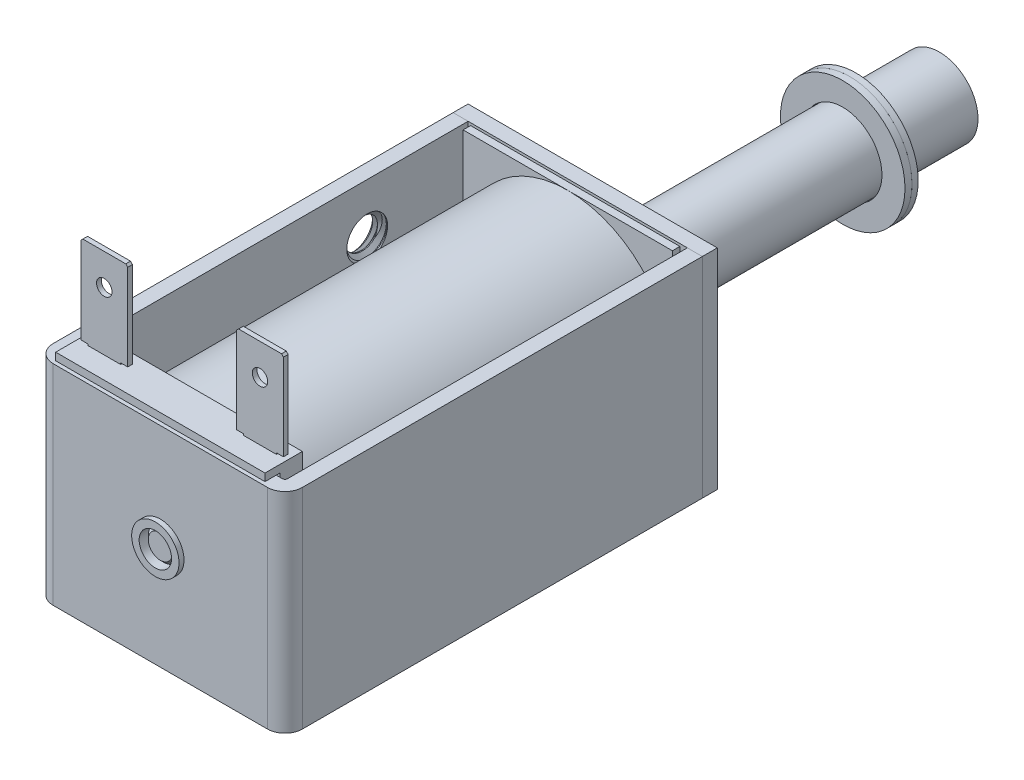
from build123d import *

# Parameters (mm, degrees)
BOSS_EXTRUDE1_DEPTH      = 10.668
BOSS_EXTRUDE1_DEPTH_BACK = 10.668
SKETCH3_W                = 25.4
SKETCH3_H                = 1.524
SKETCH4_R                = 4.34848
CUT_EXTRUDE1_DEPTH       = 1.524
SKETCH5_R                = 4.318
SKETCH5_R_2              = 4.064
BOSS_EXTRUDE2_DEPTH      = 41.656
BOSS_EXTRUDE3_DEPTH      = 10.668
BOSS_EXTRUDE3_DEPTH_BACK = 10.668
SKETCH7_R                = 2.3622
CUT_EXTRUDE2_DEPTH       = 1.524
BOSS_EXTRUDE4_START      = 0.254
SKETCH8_W                = 21.336
SKETCH8_H                = 21.336
SKETCH8_R                = 4.44627
BOSS_EXTRUDE4_DEPTH      = 0.762
SKETCH9_W                = 21.336
SKETCH9_H                = 22.479
SKETCH9_R                = 4.44627
BOSS_EXTRUDE5_DEPTH      = 2.286
SKETCH10_R               = 10.668
SKETCH10_R_2             = 4.44627
BOSS_EXTRUDE6_DEPTH      = 37.719
SKETCH11_W               = 21.336
SKETCH11_H               = 3.81
BOSS_EXTRUDE7_DEPTH      = 0.762
BOSS_EXTRUDE8_START      = -1.10236
SKETCH12_R               = 0.7874
BOSS_EXTRUDE8_DEPTH      = 0.4826
SKETCH15_W               = 0.7112
SKETCH15_H               = 2.3495
BOSS_EXTRUDE9_DEPTH      = 0.635
SKETCH17_R               = 2.0828
BOSS_EXTRUDE10_DEPTH     = 1.524
CUT_SWEEP1_PITCH         = 0.79375
CUT_SWEEP1_HEIGHT        = 2.31775
CUT_SWEEP1_RADIUS        = 2.0828
CUT_SWEEP1_START_ANGLE   = -90
SKETCH20_R               = 2.0828
BOSS_EXTRUDE11_DEPTH     = 0.79375
BOSS_EXTRUDE11_DRAFT     = -45
SKETCH21_R               = 2.0828
BOSS_EXTRUDE12_DEPTH     = 0.79375
BOSS_EXTRUDE12_DRAFT     = -45


with BuildPart() as part:
    # Sketch3 → Boss-Extrude1 (new, two sides: drawn at the far end of the back side and taken through both)
    with BuildSketch(Plane(origin=(0, 0, 0), x_dir=(1, 0, 0), z_dir=(0, 1, 0)).offset(-BOSS_EXTRUDE1_DEPTH_BACK)):
        with Locations((0, 43.307)):
            Rectangle(SKETCH3_W, SKETCH3_H)
    extrude(amount=BOSS_EXTRUDE1_DEPTH + BOSS_EXTRUDE1_DEPTH_BACK)

    # Sketch4 → Cut-Extrude1 (cut)
    with BuildSketch(Plane(origin=(0, 0, -44.069), x_dir=(-1, 0, 0), z_dir=(0, 0, -1))):
        Circle(SKETCH4_R)
    extrude(amount=-CUT_EXTRUDE1_DEPTH, mode=Mode.SUBTRACT)


with BuildPart() as body_2:
    # Sketch5 → Boss-Extrude2 (new body)
    with BuildSketch(Plane(origin=(0, 0, -44.069), x_dir=(-1, 0, 0), z_dir=(0, 0, -1))):
        Circle(SKETCH5_R)
        Circle(SKETCH5_R_2, mode=Mode.SUBTRACT)
    extrude(amount=-BOSS_EXTRUDE2_DEPTH)


with BuildPart() as body_3:
    # Sketch6 → Boss-Extrude3 (new, two sides: drawn at the far end of the back side and taken through both)
    with BuildSketch(Plane(origin=(0, 0, 0), x_dir=(1, 0, 0), z_dir=(0, 1, 0)).offset(-BOSS_EXTRUDE3_DEPTH_BACK)):
        with BuildLine():
            Line((-12.7, 42.545), (-12.7, 1.778))
            ThreePointArc((-12.7, 1.778), (-12.179235857, 0.520764143), (-10.922, 0))
            Line((-10.922, 0), (10.922, 0))
            ThreePointArc((10.922, 0), (12.179235857, 0.520764143), (12.7, 1.778))
            Line((12.7, 1.778), (12.7, 42.545))
            Line((12.7, 42.545), (11.176, 42.545))
            Line((11.176, 42.545), (11.176, 1.778))
            ThreePointArc((11.176, 1.778), (11.101605122, 1.598394878), (10.922, 1.524))
            Line((10.922, 1.524), (-10.922, 1.524))
            ThreePointArc((-10.922, 1.524), (-11.101605122, 1.598394878), (-11.176, 1.778))
            Line((-11.176, 1.778), (-11.176, 42.545))
            Line((-11.176, 42.545), (-12.7, 42.545))
        make_face()
    extrude(amount=BOSS_EXTRUDE3_DEPTH + BOSS_EXTRUDE3_DEPTH_BACK)

    # Sketch7 → Cut-Extrude2 (cut)
    with BuildSketch(Plane.XY):
        Circle(SKETCH7_R)
    extrude(amount=-CUT_EXTRUDE2_DEPTH, mode=Mode.SUBTRACT)


with BuildPart() as body_4:
    # Sketch8 → Boss-Extrude4 (new body)
    with BuildSketch(Plane.XY.offset(-42.545).offset(BOSS_EXTRUDE4_START)):
        Rectangle(SKETCH8_W, SKETCH8_H)
        with Locations(Location((0, 0, 0), (0, 0, 180))):
            Circle(SKETCH8_R, mode=Mode.SUBTRACT)
    extrude(amount=BOSS_EXTRUDE4_DEPTH)



with BuildPart() as body_5:
    # Sketch9 → Boss-Extrude5 (new body)
    with BuildSketch(Plane(origin=(0, 0, -1.524), x_dir=(-1, 0, 0), z_dir=(0, 0, -1))):
        with Locations((0, 0.5715)):
            Rectangle(SKETCH9_W, SKETCH9_H)
        Circle(SKETCH9_R, mode=Mode.SUBTRACT)
    extrude(amount=BOSS_EXTRUDE5_DEPTH)


with BuildPart() as body_4_1:
    add(body_4.part)

    add(body_5.part)  # Boss-Extrude6 merges body 5
    # Sketch10 → Boss-Extrude6 (add)
    with BuildSketch(Plane(origin=(0, 0, -3.81), x_dir=(-1, 0, 0), z_dir=(0, 0, -1))):
        with Locations(Location((0, 0, 0), (0, 0, 180))):
            Circle(SKETCH10_R)
        with Locations(Location((0, 0, 0), (0, 0, 180))):
            Circle(SKETCH10_R_2, mode=Mode.SUBTRACT)
    extrude(amount=BOSS_EXTRUDE6_DEPTH)

    # Sketch11 → Boss-Extrude7 (add)
    with BuildSketch(Plane(origin=(0, 11.811, 0), x_dir=(1, 0, 0), z_dir=(0, 1, 0))):
        with Locations((0, 1.905)):
            Rectangle(SKETCH11_W, SKETCH11_H)
    extrude(amount=-BOSS_EXTRUDE7_DEPTH)

    # Sketch12 → Boss-Extrude8 (add)
    # profile 1 of 2: a face of its own
    with BuildSketch(Plane(origin=(0, 0, -3.81), x_dir=(-1, 0, 0), z_dir=(0, 0, -1)).offset(BOSS_EXTRUDE8_START)):
        Polygon((10.32764, 11.95578), (9.6012, 11.95578), (9.6012, 11.811), (6.2738, 11.811), (6.2738, 11.95578), (5.54736, 11.95578), (5.54736, 20.75434), (5.74802, 20.955), (10.12698, 20.955), (10.32764, 20.75434), align=None)
        with Locations((7.9375, 17.78)):
            Circle(SKETCH12_R, mode=Mode.SUBTRACT)
    # profile 2 of 2: a face of its own
    with BuildSketch(Plane(origin=(0, 0, -3.81), x_dir=(-1, 0, 0), z_dir=(0, 0, -1)).offset(BOSS_EXTRUDE8_START)):
        Polygon((-10.32764, 20.75434), (-10.12698, 20.955), (-5.74802, 20.955), (-5.54736, 20.75434), (-5.54736, 11.95578), (-6.2738, 11.95578), (-6.2738, 11.811), (-9.6012, 11.811), (-9.6012, 11.95578), (-10.32764, 11.95578), align=None)
        with Locations((-7.9375, 17.78)):
            Circle(SKETCH12_R, mode=Mode.SUBTRACT)
    extrude(amount=-BOSS_EXTRUDE8_DEPTH)


with BuildPart() as body_5_2:
    # Sketch13 → Revolve1 (revolve)
    with BuildSketch(Plane(origin=(0, 0, 0), x_dir=(0, 0, -1), z_dir=(1, 0, 0)), mode=Mode.PRIVATE) as revolve1_sk:
        Polygon((-0.508, 2.413), (-0.508, 1.651), (7.9375, 1.651), (7.9375, 1.7272), (1.524, 1.7272), (1.524, 2.413), align=None)
    revolve(revolve1_sk.sketch.rotate(Axis((0, 0, 0.508), (0, 0, -1)), 90), axis=Axis((0, 0, 0.508), (0, 0, -1)))


with BuildPart() as body_6:
    # Sketch14 → Revolve2 (revolve)
    with BuildSketch(Plane(origin=(0, 0, 0), x_dir=(0, 0, -1), z_dir=(1, 0, 0)), mode=Mode.PRIVATE) as revolve2_sk:
        Polygon((-25.4, 0), (54.01056, 0), (54.01056, 3.937), (45.50156, 3.937), (45.50156, 3.15595), (44.71416, 3.15595), (44.71416, 3.937), (13.0937, 3.937), (8.3439, 1.5875), (-25.04186, 1.5875), (-25.4, 1.22936), align=None)
    revolve(revolve2_sk.sketch.rotate(Axis((0, 0, 25.4), (0, 0, -1)), 180), axis=Axis((0, 0, 25.4), (0, 0, -1)))


with BuildPart() as body_7:
    # Sketch15 → Revolve3 (revolve)
    with BuildSketch(Plane(origin=(0, 0, 0), x_dir=(0, 0, -1), z_dir=(1, 0, 0)), mode=Mode.PRIVATE) as revolve3_sk:
        with Locations((44.51096, 5.17525)):
            Rectangle(SKETCH15_W, SKETCH15_H)
    revolve(revolve3_sk.sketch.rotate(Axis((0, 0, -44.069), (0, 0, -1)), 90), axis=Axis((0, 0, -44.069), (0, 0, -1)))


with BuildPart() as body_8:
    # Sketch16 → Boss-Extrude9 (new body)
    with BuildSketch(Plane.XY.offset(-45.50156)):
        with BuildLine():
            Line((3.011307464, -4.901818506), (2.34061, -2.1188636))
            ThreePointArc((2.34061, -2.1188636), (2.946002277, -1.135389234), (3.15722, 0))
            Line((3.15722, 0), (4.402296316, 0))
            ThreePointArc((4.402296316, 0), (4.732015145, 0.146396421), (4.844547668, 0.489154133))
            ThreePointArc((4.844547668, 0.489154133), (4.005584758, 2.768429992), (2.170002044, 4.358899517))
            ThreePointArc((2.170002044, 4.358899517), (1.809593972, 4.374787869), (1.556101003, 4.118101811))
            Line((1.556101003, 4.118101811), (1.115997846, 2.953402603))
            ThreePointArc((1.115997846, 2.953402603), (0, 3.15722), (-1.115997846, 2.953402603))
            Line((-1.115997846, 2.953402603), (-1.556101003, 4.118101811))
            ThreePointArc((-1.556101003, 4.118101811), (-1.809593972, 4.374787869), (-2.170002044, 4.358899517))
            ThreePointArc((-2.170002044, 4.358899517), (-4.005584758, 2.768429992), (-4.844547668, 0.489154133))
            ThreePointArc((-4.844547668, 0.489154133), (-4.732015145, 0.146396421), (-4.402296316, 0))
            Line((-4.402296316, 0), (-3.15722, 0))
            ThreePointArc((-3.15722, 0), (-2.946002277, -1.135389234), (-2.34061, -2.1188636))
            Line((-2.34061, -2.1188636), (-3.011307464, -4.901818506))
            ThreePointArc((-3.011307464, -4.901818506), (-3.288560847, -5.214321263), (-3.702618468, -5.158790214))
            ThreePointArc((-3.702618468, -5.158790214), (0, 6.35), (3.702618468, -5.158790214))
            ThreePointArc((3.702618468, -5.158790214), (3.288560847, -5.214321263), (3.011307464, -4.901818506))
        make_face()
    extrude(amount=BOSS_EXTRUDE9_DEPTH)


with BuildPart() as body_6_1:
    # Body-Move/Copy1: moved
    add(body_6.part.moved(Location((0, 0, -25.4))))


with BuildPart() as body_7_1:
    # Body-Move/Copy1: moved
    add(body_7.part.moved(Location((0, 0, -25.4))))


with BuildPart() as body_8_1:
    # Body-Move/Copy1: moved
    add(body_8.part.moved(Location((0, 0, -25.4))))


with BuildPart() as body_9:
    # Sketch17 → Boss-Extrude10 (new body)
    with BuildSketch(Plane(origin=(-12.7, 0, 0), x_dir=(0, 0, -1), z_dir=(1, 0, 0))):
        with Locations(Location((32.258, 5.5499, 0), (0, 0, 180))):
            Circle(SKETCH17_R)
    extrude(amount=BOSS_EXTRUDE10_DEPTH)

    # Cut-Sweep1: sweep along a helix
    with BuildLine() as cut_sweep1_path:
        add(Helix(CUT_SWEEP1_PITCH, CUT_SWEEP1_HEIGHT, CUT_SWEEP1_RADIUS, center=(-12.7, 5.5499, -32.258), direction=(1, 0, 0), mode=Mode.PRIVATE).rotate(Axis((-12.7, 5.5499, -32.258), (1, 0, 0)), CUT_SWEEP1_START_ANGLE))
    # Sketch19 → Cut-Sweep1 (sweep, cut)
    with BuildSketch(Plane.XY.offset(-32.258)):
        Polygon((-13.096875, 7.117144252), (-12.99765625, 7.117144252), (-12.675195312, 7.675662979), (-13.419335937, 7.675662979), align=None)
    sweep(path=cut_sweep1_path.line, is_frenet=True, mode=Mode.SUBTRACT)


with BuildPart() as boss_extrude11_tool:
    # Sketch20 → Boss-Extrude11 (with draft: the straight prism first)
    with BuildSketch(Plane.ZY.offset(12.7)):
        with Locations((-32.258, 5.5499)):
            Circle(SKETCH20_R)
    extrude(amount=-BOSS_EXTRUDE11_DEPTH)
    # Boss-Extrude11: the draft: its side faces are tilted about the plane it starts from
    boss_extrude11_sides = [boss_extrude11_tool.faces().sort_by_distance(p)[0] for p in [
        (-12.303125, 5.5499, -34.3408),
    ]]
    draft(boss_extrude11_sides, Plane.ZY.offset(12.7), BOSS_EXTRUDE11_DRAFT)


with BuildPart() as body_9_1:
    add(body_9.part)

    # Boss-Extrude11: add boss_extrude11_tool
    add(boss_extrude11_tool.part)


with BuildPart() as boss_extrude12_tool:
    # Sketch21 → Boss-Extrude12 (with draft: the straight prism first)
    with BuildSketch(Plane(origin=(-11.176, 0, 0), x_dir=(0, 0, -1), z_dir=(1, 0, 0))):
        with Locations((32.258, 5.5499)):
            Circle(SKETCH21_R)
    extrude(amount=-BOSS_EXTRUDE12_DEPTH)
    # Boss-Extrude12: the draft: its side faces are tilted about the plane it starts from
    boss_extrude12_sides = [boss_extrude12_tool.faces().sort_by_distance(p)[0] for p in [
        (-11.572875, 5.5499, -30.1752),
    ]]
    draft(boss_extrude12_sides, Plane(origin=(-11.176, 0, 0), x_dir=(0, 0, -1), z_dir=(1, 0, 0)), BOSS_EXTRUDE12_DRAFT)


with BuildPart() as body_9_2:
    add(body_9_1.part)

    # Boss-Extrude12: add boss_extrude12_tool
    add(boss_extrude12_tool.part)


with BuildPart() as body_10:
    # Body-Move/Copy2: copy of body 9
    add(body_9_2.part.moved(Location((0, -11.0998, 12.7))))


with BuildPart() as body_3_1:
    add(body_3.part)

    # Combine1: cut body 9, body 10
    add(body_9_2.part, mode=Mode.SUBTRACT)
    add(body_10.part, mode=Mode.SUBTRACT)


solid = Compound([part.part, body_2.part, body_4_1.part, body_5_2.part, body_6_1.part, body_7_1.part, body_8_1.part, body_3_1.part])
